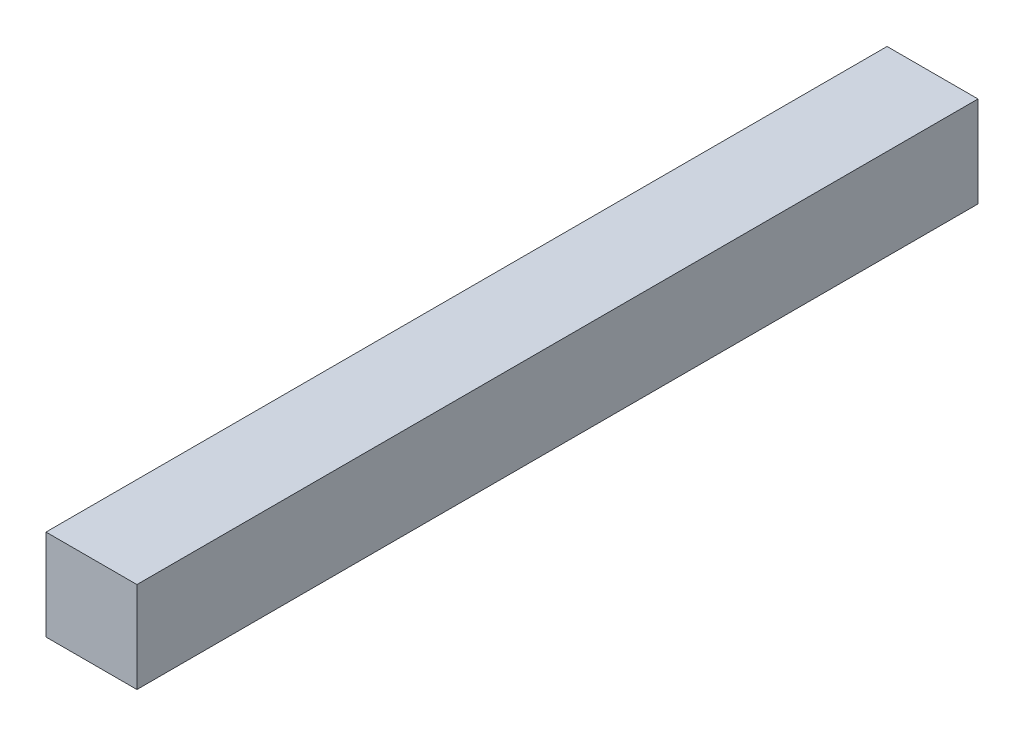
from build123d import *

# Parameters (mm, degrees)
SKETCH1_W           = 185
SKETCH1_H           = 20
BOSS_EXTRUDE1_DEPTH = 20
SKETCH2_W           = 0.610576923
SKETCH2_H           = 3.866987179
CUT_EXTRUDE1_DEPTH  = 4


with BuildPart() as part:
    # Sketch1 → Boss-Extrude1 (new body)
    with BuildSketch(Plane(origin=(0, 0, 0), x_dir=(0, 0, -1), z_dir=(1, 0, 0))):
        Rectangle(SKETCH1_W, SKETCH1_H)
    extrude(amount=BOSS_EXTRUDE1_DEPTH)

    # Sketch2 → Cut-Extrude1 (cut)
    # profile 1 of 6: a face of its own
    with BuildSketch(Plane(origin=(0, 0, 0), x_dir=(0, 0, -1), z_dir=(1, 0, 0))):
        with BuildLine():
            Line((-6.919871795, 5.427350427), (-7.530448718, 5.427350427))
            Line((-7.530448718, 5.427350427), (-7.530448718, 3.136626936))
            add(Edge.make_bspline(
                [(-7.530448718, 3.136626936), (-7.589937515, 3.200496063), (-7.706552127, 3.325697342), (-7.900316445, 3.487703852), (-8.10059134, 3.627202133), (-8.311539512, 3.739205359), (-8.531188767, 3.826800408), (-8.760096572, 3.889415018), (-8.998024221, 3.927467645), (-9.159574529, 3.932355358), (-9.241336138, 3.93482906)],
                knots=[0, 0, 0, 0, 1.07415008, 2.105633337, 3.103998732, 4.075565931, 5.040540589, 6.010859238, 6.993283574, 8, 8, 8, 8], degree=3))
            add(Edge.make_bspline(
                [(-9.241336138, 3.93482906), (-9.283409296, 3.934337126), (-9.366281857, 3.93336815), (-9.488704978, 3.922128741), (-9.607604147, 3.905280786), (-9.723197381, 3.88235118), (-9.835113748, 3.851419616), (-9.943277915, 3.812987353), (-10.048171191, 3.768628269), (-10.148999233, 3.718031271), (-10.243985826, 3.660350246), (-10.334116911, 3.599554702), (-10.417436699, 3.533332783), (-10.49409228, 3.462180231), (-10.563863032, 3.385644331), (-10.627905953, 3.305289996), (-10.684159131, 3.219345233), (-10.736060489, 3.128593488), (-10.781459582, 3.028065022), (-10.81896415, 2.915689145), (-10.850159397, 2.790384349), (-10.878507113, 2.652678599), (-10.897220532, 2.501273018), (-10.91255918, 2.337281871), (-10.920524704, 2.160417422), (-10.921854903, 2.038089349), (-10.922542735, 1.974834736)],
                knots=[0, 0, 0, 0, 1.021683283, 2.012435314, 2.983473585, 3.937869172, 4.872808728, 5.801185558, 6.724190829, 7.637729951, 8.538560957, 9.421760501, 10.276949778, 11.121084872, 11.959396615, 12.790471507, 13.614111827, 14.451940127, 15.327769077, 16.288588017, 17.325266595, 18.463133286, 19.701266581, 21.028475566, 22.463454662, 24, 24, 24, 24], degree=3))
            Line((-10.922542735, 1.974834736), (-10.922542735, 0))
            Line((-10.922542735, 0), (-10.311965812, 0))
            Line((-10.311965812, 0), (-10.311965812, 1.819010417))
            add(Edge.make_bspline(
                [(-10.311965812, 1.819010417), (-10.311827288, 1.871662121), (-10.311562298, 1.972382366), (-10.307806369, 2.116532517), (-10.304598706, 2.247366394), (-10.296542341, 2.364276534), (-10.288731222, 2.467583112), (-10.277989452, 2.557011842), (-10.266367051, 2.632986732), (-10.254680373, 2.678406458), (-10.249424079, 2.698834802)],
                knots=[0, 0, 0, 0, 1.429454469, 2.734479441, 3.915096125, 4.982083123, 5.9158061, 6.72734519, 7.427600459, 8, 8, 8, 8], degree=3))
            add(Edge.make_bspline(
                [(-10.249424079, 2.698834802), (-10.239985757, 2.729726568), (-10.221515013, 2.790181586), (-10.186611128, 2.876655997), (-10.144358713, 2.95653606), (-10.098729957, 3.031765724), (-10.045819343, 3.100068016), (-9.988807082, 3.162942351), (-9.925466544, 3.219586635), (-9.856734918, 3.270557736), (-9.782039836, 3.314614931), (-9.702911659, 3.354998099), (-9.617360814, 3.387028953), (-9.526256903, 3.413703066), (-9.430300289, 3.434776007), (-9.328305974, 3.449745892), (-9.220976062, 3.457864224), (-9.147359552, 3.459237149), (-9.109892495, 3.459935897)],
                knots=[0, 0, 0, 0, 1.040890899, 2.037017845, 2.999772166, 3.951073996, 4.869069183, 5.779972212, 6.683224964, 7.603478097, 8.53319658, 9.475456454, 10.463214634, 11.472278836, 12.533409461, 13.627045924, 14.792287113, 16, 16, 16, 16], degree=3))
            add(Edge.make_bspline(
                [(-9.109892495, 3.459935897), (-9.066394699, 3.459223869), (-8.980585668, 3.457819236), (-8.853334506, 3.443522416), (-8.729799904, 3.420099373), (-8.608858093, 3.388835222), (-8.492901364, 3.345549076), (-8.378879204, 3.2959497), (-8.269419077, 3.235227369), (-8.163550396, 3.166894898), (-8.065199367, 3.09071371), (-7.972982493, 3.011268091), (-7.890300771, 2.926541357), (-7.816908935, 2.83692262), (-7.751760677, 2.743691072), (-7.696400657, 2.645229123), (-7.649577158, 2.542696659), (-7.625270959, 2.471504885), (-7.61313101, 2.435947516)],
                knots=[0, 0, 0, 0, 1.077093923, 2.124806198, 3.16676328, 4.190026369, 5.214449133, 6.229293254, 7.267272823, 8.311139597, 9.347457364, 10.346171291, 11.324074378, 12.275494987, 13.212638205, 14.137563464, 15.069789411, 16, 16, 16, 16], degree=3))
            add(Edge.make_bspline(
                [(-7.61313101, 2.435947516), (-7.606438896, 2.410226644), (-7.591873315, 2.354244418), (-7.57588891, 2.261692315), (-7.56032188, 2.154351492), (-7.551402493, 2.031759), (-7.540810311, 1.894409359), (-7.535424096, 1.742364007), (-7.53062233, 1.575234639), (-7.530508315, 1.458958548), (-7.530448718, 1.398178753)],
                knots=[0, 0, 0, 0, 0.610940434, 1.329729645, 2.15826949, 3.104343598, 4.155103487, 5.326215764, 6.602360509, 8, 8, 8, 8], degree=3))
            Line((-7.530448718, 1.398178753), (-7.530448718, 0))
            Line((-7.530448718, 0), (-6.919871795, 0))
            Line((-6.919871795, 0), (-6.919871795, 5.427350427))
        make_face()
    # profile 2 of 6: a face of its own
    with BuildSketch(Plane(origin=(0, 0, 0), x_dir=(0, 0, -1), z_dir=(1, 0, 0))):
        Polygon((-4.545405983, 5.427350427), (-5.155982906, 5.427350427), (-5.155982906, 3.866987179), (-5.97008547, 3.866987179), (-5.97008547, 3.392094017), (-5.155982906, 3.392094017), (-5.155982906, 0), (-4.545405983, 0), (-4.545405983, 3.392094017), (-3.731303419, 3.392094017), (-3.731303419, 3.866987179), (-4.545405983, 3.866987179), align=None)
    # profile 3 of 6: a face of its own
    with BuildSketch(Plane(origin=(0, 0, 0), x_dir=(0, 0, -1), z_dir=(1, 0, 0))):
        with BuildLine():
            Line((-2.781517094, 5.427350427), (-2.781517094, 0))
            Line((-2.781517094, 0), (-2.170940171, 0))
            Line((-2.170940171, 0), (-2.170940171, 0.668878539))
            add(Edge.make_bspline(
                [(-2.170940171, 0.668878539), (-2.107197314, 0.608035592), (-1.981438955, 0.487998469), (-1.772874793, 0.335611435), (-1.554271068, 0.206532799), (-1.323001979, 0.104927988), (-1.08084034, 0.02741884), (-0.828050042, -0.027154925), (-0.564587777, -0.062587478), (-0.384906991, -0.066071817), (-0.293628138, -0.06784188)],
                knots=[0, 0, 0, 0, 1.019195269, 2.010771559, 2.98243828, 3.953071221, 4.928459054, 5.92097988, 6.943846046, 8, 8, 8, 8], degree=3))
            add(Edge.make_bspline(
                [(-0.293628138, -0.06784188), (-0.212278362, -0.066002831), (-0.052283162, -0.062385869), (0.183121379, -0.034001052), (0.409392822, 0.011251369), (0.626804776, 0.074668338), (0.834456436, 0.15811201), (1.033433644, 0.259229676), (1.224057648, 0.378131913), (1.402425797, 0.515017965), (1.565607673, 0.664315202), (1.710295541, 0.822088218), (1.830901766, 0.990075471), (1.930012987, 1.16570022), (2.008284628, 1.348979764), (2.063522173, 1.540436511), (2.097425013, 1.739709575), (2.101191805, 1.875411219), (2.103098291, 1.944093884)],
                knots=[0, 0, 0, 0, 1.123240242, 2.209140012, 3.269531841, 4.307200378, 5.33208785, 6.355638419, 7.386041063, 8.430389251, 9.456205716, 10.437372787, 11.381331206, 12.305608918, 13.217422722, 14.127040075, 15.052038913, 16, 16, 16, 16], degree=3))
            add(Edge.make_bspline(
                [(2.103098291, 1.944093884), (2.10128984, 2.011382557), (2.097706217, 2.144721702), (2.062166318, 2.34027709), (2.007012149, 2.528913951), (1.929273732, 2.70983897), (1.828565066, 2.88290585), (1.705138002, 3.047530684), (1.561811379, 3.206685319), (1.395925771, 3.35368684), (1.21637717, 3.489943896), (1.024698002, 3.609025132), (0.824077118, 3.710294885), (0.613898841, 3.791540495), (0.395841081, 3.857162653), (0.168313492, 3.902272425), (-0.068258603, 3.929038308), (-0.228896452, 3.932876932), (-0.310588608, 3.93482906)],
                knots=[0, 0, 0, 0, 0.929834157, 1.842558112, 2.739444127, 3.643610427, 4.558947396, 5.502170324, 6.484781267, 7.516063553, 8.562884444, 9.598949608, 10.63273007, 11.666418114, 12.711686399, 13.778429582, 14.870223435, 16, 16, 16, 16], degree=3))
            add(Edge.make_bspline(
                [(-0.310588608, 3.93482906), (-0.40435421, 3.932473736), (-0.588098644, 3.927858208), (-0.857167691, 3.888987116), (-1.112161098, 3.824331799), (-1.353817213, 3.735077186), (-1.581052843, 3.619757654), (-1.794413767, 3.479069951), (-1.993045171, 3.311811238), (-2.111142456, 3.183550396), (-2.170940171, 3.118606437)],
                knots=[0, 0, 0, 0, 1.071763051, 2.100242443, 3.100732335, 4.074859654, 5.039734977, 6.007912089, 6.991320556, 8, 8, 8, 8], degree=3))
            Line((-2.170940171, 3.118606437), (-2.170940171, 5.427350427))
            Line((-2.170940171, 5.427350427), (-2.781517094, 5.427350427))
        make_face()
        with BuildLine():
            add(Edge.make_bspline(
                [(-0.34132946, 3.459935897), (-0.259923832, 3.457460499), (-0.099430721, 3.452580193), (0.136139179, 3.414838077), (0.36171964, 3.351613321), (0.575983738, 3.265320627), (0.77572267, 3.156888602), (0.954837841, 3.025800834), (1.112897646, 2.874406983), (1.247219164, 2.705341332), (1.356089663, 2.523345649), (1.433893635, 2.333264873), (1.483248118, 2.137739059), (1.48942832, 2.005150993), (1.492521368, 1.938793737)],
                knots=[0, 0, 0, 0, 1.109383849, 2.187176339, 3.242518702, 4.297102297, 5.329675001, 6.332611146, 7.31376118, 8.304500856, 9.267727633, 10.194431231, 11.096354645, 12, 12, 12, 12], degree=3))
            add(Edge.make_bspline(
                [(1.492521368, 1.938793737), (1.4893759, 1.872804607), (1.48307419, 1.740600272), (1.434200168, 1.54510488), (1.354338932, 1.354902032), (1.245550269, 1.171236359), (1.109292292, 1.001117052), (0.951038249, 0.847449942), (0.770137177, 0.715521), (0.569959315, 0.605220441), (0.356136337, 0.516035794), (0.131682293, 0.454095096), (-0.099974662, 0.41401026), (-0.257420104, 0.409389461), (-0.337089343, 0.407051282)],
                knots=[0, 0, 0, 0, 0.899067793, 1.801215763, 2.729988959, 3.704201737, 4.70195815, 5.693506531, 6.703426643, 7.745129962, 8.803622927, 9.854588774, 10.914396774, 12, 12, 12, 12], degree=3))
            add(Edge.make_bspline(
                [(-0.337089343, 0.407051282), (-0.417435819, 0.40956763), (-0.577218663, 0.414571821), (-0.813366448, 0.452582003), (-1.042989176, 0.515430897), (-1.262563953, 0.602843078), (-1.467239879, 0.710637789), (-1.650426163, 0.837652669), (-1.806649259, 0.984783719), (-1.917000372, 1.120737972), (-1.990460811, 1.237459085), (-2.039822924, 1.327219222), (-2.079836584, 1.420841861), (-2.112454099, 1.516664541), (-2.13996274, 1.61443661), (-2.156941461, 1.715752236), (-2.169751987, 1.819390625), (-2.170542214, 1.889637278), (-2.170940171, 1.925013355)],
                knots=[0, 0, 0, 0, 1.454679526, 2.892881476, 4.319605243, 5.758675393, 7.164275054, 8.50112553, 9.782353562, 11.038615131, 11.659977969, 12.278467245, 12.891870366, 13.501019391, 14.111108876, 14.72870364, 15.359777648, 16, 16, 16, 16], degree=3))
            add(Edge.make_bspline(
                [(-2.170940171, 1.925013355), (-2.16927316, 1.978461433), (-2.165987633, 2.083802709), (-2.14104884, 2.238559513), (-2.099963439, 2.386731748), (-2.040711716, 2.527611545), (-1.966166593, 2.66229477), (-1.874392512, 2.789679304), (-1.766233448, 2.910305363), (-1.643086022, 3.022512812), (-1.50790168, 3.124466672), (-1.364679297, 3.215649495), (-1.212246852, 3.290760642), (-1.052412354, 3.352103226), (-0.885682228, 3.401697267), (-0.710864474, 3.434476018), (-0.528842208, 3.457115254), (-0.404650996, 3.458983389), (-0.34132946, 3.459935897)],
                knots=[0, 0, 0, 0, 0.963959541, 1.899876124, 2.820204683, 3.731815019, 4.650685228, 5.591841201, 6.55801154, 7.568749471, 8.592570704, 9.609561673, 10.627351536, 11.652580929, 12.695514932, 13.760714325, 14.858252484, 16, 16, 16, 16], degree=3))
        make_face(mode=Mode.SUBTRACT)
    # profile 4 of 6: a face of its own
    with BuildSketch(Plane(origin=(0, 0, 0), x_dir=(0, 0, -1), z_dir=(1, 0, 0))):
        with BuildLine():
            add(Edge.make_bspline(
                [(3.495976896, 5.495192308), (3.461941892, 5.493815886), (3.395572982, 5.491131837), (3.299777424, 5.468756526), (3.212755334, 5.429515665), (3.134856731, 5.378176197), (3.068825525, 5.31645467), (3.019829854, 5.245930469), (2.990539293, 5.167680741), (2.986890119, 5.113466684), (2.985042735, 5.086020967)],
                knots=[0, 0, 0, 0, 1.126292746, 2.196292449, 3.23347918, 4.271985151, 5.273442343, 6.208143861, 7.092877767, 8, 8, 8, 8], degree=3))
            add(Edge.make_bspline(
                [(2.985042735, 5.086020967), (2.986928899, 5.059287203), (2.990679617, 5.006125968), (3.019832722, 4.929204932), (3.06918988, 4.859738512), (3.134813416, 4.798073789), (3.212767084, 4.746775084), (3.299774187, 4.707523129), (3.395573853, 4.685150858), (3.461942187, 4.682466384), (3.495976896, 4.681089744)],
                knots=[0, 0, 0, 0, 0.888755228, 1.767327854, 2.697484928, 3.7044632, 4.748694502, 5.79159929, 6.86749795, 8, 8, 8, 8], degree=3))
            add(Edge.make_bspline(
                [(3.495976896, 4.681089744), (3.529308856, 4.682477743), (3.594632821, 4.685197943), (3.689294198, 4.707730871), (3.776033916, 4.7467425), (3.853872287, 4.798137952), (3.919738887, 4.859392655), (3.96772033, 4.929554635), (3.99709173, 5.006086229), (4.000804074, 5.059273906), (4.00267094, 5.086020967)],
                knots=[0, 0, 0, 0, 1.114826149, 2.184835993, 3.233187219, 4.282871886, 5.295108974, 6.223442501, 7.10660336, 8, 8, 8, 8], degree=3))
            add(Edge.make_bspline(
                [(4.00267094, 5.086020967), (4.000843548, 5.113480249), (3.997233864, 5.1677211), (3.967718285, 5.245582737), (3.920104049, 5.316795577), (3.853829421, 5.378113213), (3.776045548, 5.429547933), (3.68929103, 5.468548898), (3.594633659, 5.491084712), (3.529309139, 5.493804513), (3.495976896, 5.495192308)],
                knots=[0, 0, 0, 0, 0.911825585, 1.801146763, 2.734119375, 3.740769039, 4.784659576, 5.827224033, 6.891327554, 8, 8, 8, 8], degree=3))
        make_face()
    # profile 5 of 6: a face of its own
    with BuildSketch(Plane(origin=(0, 0, 0), x_dir=(0, 0, -1), z_dir=(1, 0, 0))):
        with Locations((3.493856838, 1.93349359)):
            Rectangle(SKETCH2_W, SKETCH2_H)
    # profile 6 of 6: a face of its own
    with BuildSketch(Plane(origin=(0, 0, 0), x_dir=(0, 0, -1), z_dir=(1, 0, 0))):
        Polygon((11.533119658, 3.866987179), (10.868481237, 3.866987179), (9.463942308, 1.085470085), (7.987321381, 3.866987179), (7.821956798, 3.866987179), (6.343215812, 1.085470085), (4.924896501, 3.866987179), (4.274038462, 3.866987179), (6.245693109, 0), (6.423778045, 0), (7.90357906, 2.781517094), (9.379139957, 0), (9.58054554, 0), align=None)
    extrude(amount=CUT_EXTRUDE1_DEPTH, mode=Mode.SUBTRACT)


solid = part.part
